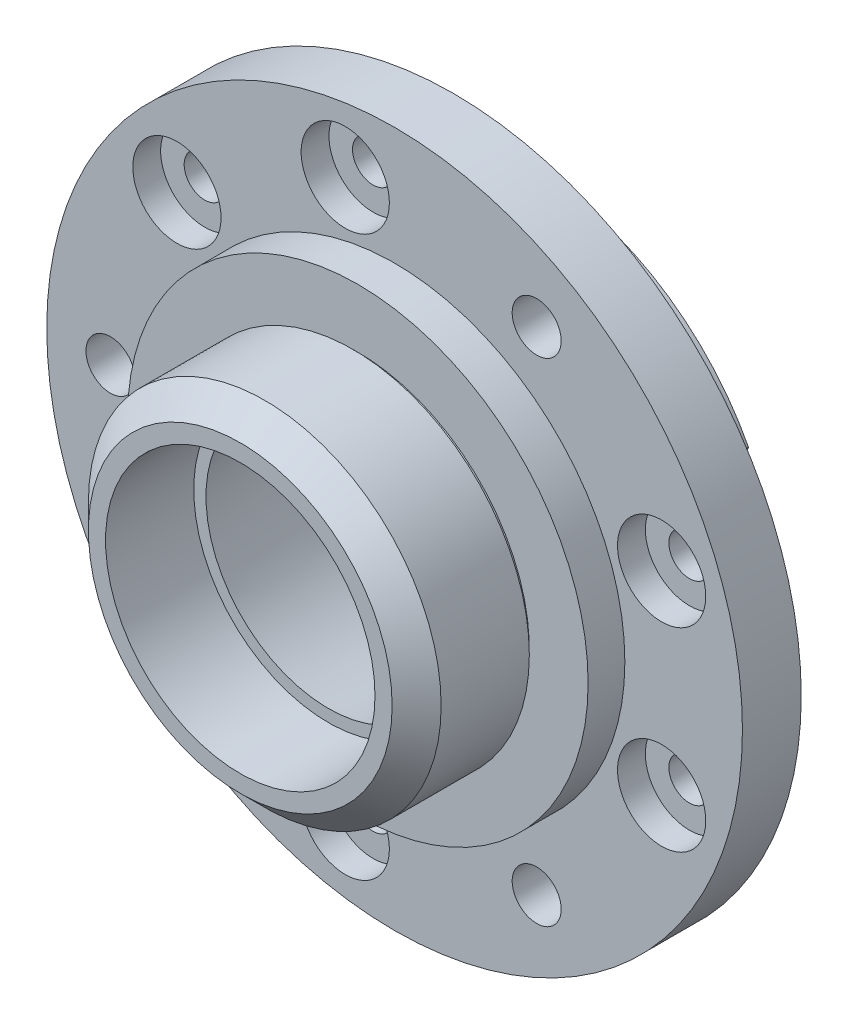
from build123d import *

# Parameters (mm, degrees)
SKETCH4_R                               = 5
CUT_EXTRUDE1_DEPTH                      = 106.234262481
CBORE_FOR_M8_HEX_HEAD_BOLT1_D           = 8.4
CBORE_FOR_M8_HEX_HEAD_BOLT1_DEPTH       = 28.41
CBORE_FOR_M8_HEX_HEAD_BOLT1_CBORE_D     = 18.01
CBORE_FOR_M8_HEX_HEAD_BOLT1_CBORE_DEPTH = 5.68
CBORE_FOR_M8_HEX_HEAD_BOLT1_TIP         = 2.5236146
CHAMFER1_SIZE                           = 5
SKETCH8_R                               = 10
CUT_EXTRUDE2_DEPTH                      = 15
CIRPATTERN1_COUNT                       = 9


with BuildPart() as part:
    # Sketch2 → Revolve1 (revolve)
    with BuildSketch(Plane(origin=(0, 0, 0), x_dir=(1, 0, 0), z_dir=(0, 1, 0))):
        Polygon((49, 0), (71, 0), (71, 12), (51, 12), (51, 27), (31, 27), (31, 25), (31, 9), (28, 9), (25, -13.5), (27.5, -13.5), (27.5, -26.5), (27.5, -31.5), (47, -31.5), (47, -9.5), (47, -2), (47, 0), align=None)
    revolve(axis=Axis((0, 0, 21.110532956), (0, 0, -1)))

    # Sketch4 → Cut-Extrude1 (cut, through all)
    with BuildSketch(Plane.XY):
        with Locations((29, -50.229473419)):
            Circle(SKETCH4_R)
        with Locations((29, 50.22947342)):
            Circle(SKETCH4_R)
        with Locations((-58, 0)):
            Circle(SKETCH4_R)
    extrude(amount=-CUT_EXTRUDE1_DEPTH, mode=Mode.SUBTRACT)

    # CBORE for M8 Hex Head Bolt1
    with Locations(Plane.XY):
        with Locations((-10.071594305, 57.118849675), (-44.430577701, 37.281681362), (-44.430577701, -37.281681362), (-10.071594305, -57.118849675), (54.502172006, -19.837168313), (54.502172006, 19.837168313)):
            CounterBoreHole(CBORE_FOR_M8_HEX_HEAD_BOLT1_D / 2, CBORE_FOR_M8_HEX_HEAD_BOLT1_CBORE_D / 2, CBORE_FOR_M8_HEX_HEAD_BOLT1_CBORE_DEPTH, depth=CBORE_FOR_M8_HEX_HEAD_BOLT1_DEPTH)
            with Locations((0, 0, -(CBORE_FOR_M8_HEX_HEAD_BOLT1_DEPTH + CBORE_FOR_M8_HEX_HEAD_BOLT1_TIP / 2))):  # 118° drill point
                Cone(0, CBORE_FOR_M8_HEX_HEAD_BOLT1_D / 2, CBORE_FOR_M8_HEX_HEAD_BOLT1_TIP, mode=Mode.SUBTRACT)

    # Sketch7 → Cut-Revolve1 (revolve, cut)
    with BuildSketch(Plane(origin=(0, 0, 0), x_dir=(1, 0, 0), z_dir=(0, 1, 0)), mode=Mode.PRIVATE) as cut_revolve1_sk:
        Polygon((47, -9.5), (47, -7.5), (35, -7.5), (35, -8.5), (36, -8.5), (36, -31.5), (67.825, -31.5), (67.825, -9.5), align=None)
    revolve(cut_revolve1_sk.sketch.rotate(Axis((0, 0, 7.5), (0, 0, 1)), 180), axis=Axis((0, 0, 7.5), (0, 0, 1)), mode=Mode.SUBTRACT)

    # Chamfer1
    chamfer1_edges = [part.edges().sort_by_distance(p)[0] for p in [
        (36, 0, 31.5),
    ]]
    chamfer(chamfer1_edges, length=CHAMFER1_SIZE)

    # Sketch8 → Cut-Extrude2 (cut)
    with BuildSketch(Plane(origin=(0, 0, -27), x_dir=(-1, 0, 0), z_dir=(0, 0, -1))):
        with Locations((44.430577701, 37.281681362)):
            Circle(SKETCH8_R)
    cut_extrude2 = extrude(amount=-CUT_EXTRUDE2_DEPTH, mode=Mode.SUBTRACT)

    # CirPattern1: Cut-Extrude2 ×9 about axis, 3 skipped
    cirpattern1_axis = Axis((0, 0, -12), (0, 0, 1))
    add([cut_extrude2.rotate(cirpattern1_axis, i * 360 / CIRPATTERN1_COUNT) for i in range(1, CIRPATTERN1_COUNT) if i not in (1, 4, 7)], mode=Mode.SUBTRACT)


solid = part.part
